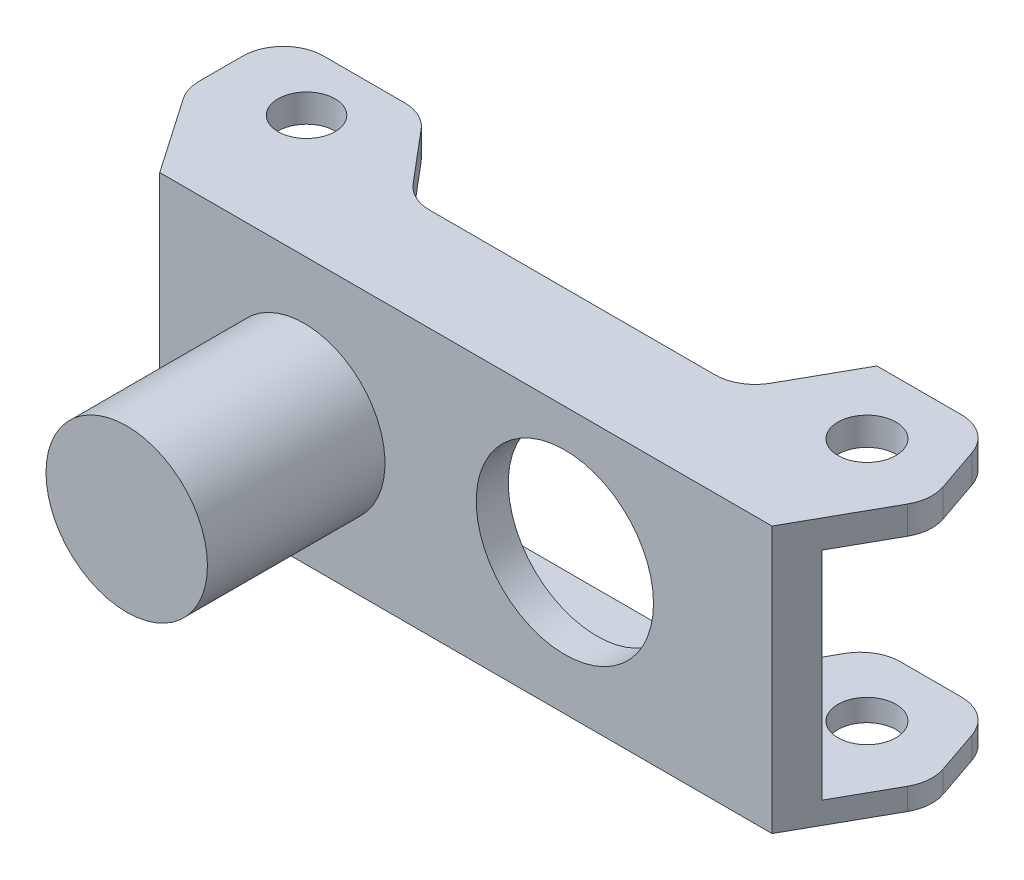
from build123d import *

# Parameters (mm, degrees)
SKETCH1_R          = 10
EXTRUDE1_DEPTH     = 15
EXTRUDE2_START     = 7
SKETCH2_R          = 10
EXTRUDE2_DEPTH     = 7
EXTRUDE5_DEPTH     = 33
SKETCH6_W          = 21.871062772
SKETCH6_H          = 26.824754441
CUT_EXTRUDE1_DEPTH = 101.943790616
SKETCH7_R          = 3.531045805
SKETCH7_R_2        = 3.594142414
CUT_EXTRUDE2_DEPTH = 81.795684194
FILLET6_R          = 5
SKETCH8_R          = 10.980976462
CUT_EXTRUDE3_DEPTH = 79.017105375


with BuildPart() as part:
    # Sketch1 → Extrude1 (new body)
    with BuildSketch(Plane.XY):
        with Locations((2, -17.227058485)):
            Circle(SKETCH1_R)
    extrude(amount=EXTRUDE1_DEPTH)

    # Sketch2 → Extrude2 (add)
    with BuildSketch(Plane(origin=(0, 0, 0), x_dir=(-1, 0, 0), z_dir=(0, 0, -1)).offset(EXTRUDE2_START)):
        with Locations((-2, -17.227058485)):
            Circle(SKETCH2_R)
    extrude(amount=-EXTRUDE2_DEPTH)

    # Sketch5 → Extrude5 (add)
    with BuildSketch(Plane(origin=(0, 0, 0), x_dir=(1, 0, 0), z_dir=(0, 1, 0))):
        Polygon((-15.907949581, 7), (-23.26436451, 17.67616864), (-23.26436451, 29.651727827), (-5.884555097, 29.651727827), (2.510054524, 19.69092733), (43.11444927, 19.69092733), (49.273308281, 30.678204329), (63.301820472, 30.678204329), (67.065567645, 19.69092733), (59.951736606, 7), align=None)
    extrude(amount=-EXTRUDE5_DEPTH)

    # Sketch6 → Cut-Extrude1 (cut, through all)
    with BuildSketch(Plane.ZY.offset(23.26436451)):
        with Locations((-21.908176834, -16.872312291)):
            Rectangle(SKETCH6_W, SKETCH6_H)
    extrude(amount=-CUT_EXTRUDE1_DEPTH, mode=Mode.SUBTRACT)

    # Sketch7 → Cut-Extrude2 (cut, through all)
    with BuildSketch(Plane(origin=(0, 0, 0), x_dir=(-1, 0, 0), z_dir=(0, 1, 0))):
        with Locations((12.963937966, -22.243817104)):
            Circle(SKETCH7_R)
        with Locations((-56.470516278, -22.243817104)):
            Circle(SKETCH7_R_2)
    extrude(amount=-CUT_EXTRUDE2_DEPTH, mode=Mode.SUBTRACT)

    # Fillet6
    fillet6_edges = [part.edges().sort_by_distance(p)[0] for p in [
        (67.065567645, -31.642344755, -19.69092733),
        (67.065567645, -1.729967535, -19.69092733),
        (63.301820472, -1.729967535, -30.678204329),
        (63.301820472, -31.642344755, -30.678204329),
        (49.273308281, -31.642344755, -30.678204329),
        (43.11444927, -31.642344755, -19.69092733),
        (43.11444927, -1.729967535, -19.69092733),
        (2.510054524, -31.642344755, -19.69092733),
        (2.510054524, -1.729967535, -19.69092733),
        (-5.884555097, -1.729967535, -29.651727827),
        (-5.884555097, -31.642344755, -29.651727827),
        (-23.26436451, -31.642344755, -17.67616864),
        (-23.26436451, -1.729967535, -17.67616864),
        (-23.26436451, -1.729967535, -29.651727827),
        (-23.26436451, -31.642344755, -29.651727827),
    ]]
    fillet(fillet6_edges, radius=FILLET6_R)

    # Sketch8 → Cut-Extrude3 (cut, through all)
    with BuildSketch(Plane.XY.offset(-7)):
        with Locations((34.285400433, -15.652526202)):
            Circle(SKETCH8_R)
    extrude(amount=-CUT_EXTRUDE3_DEPTH, mode=Mode.SUBTRACT)


solid = part.part
